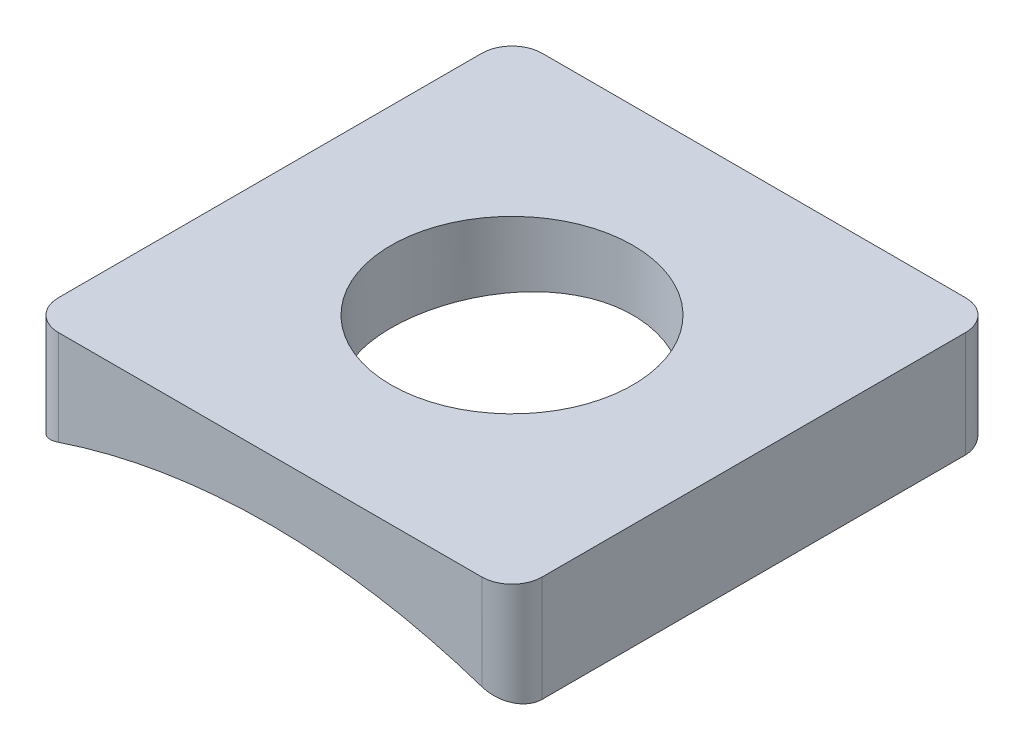
from build123d import *
from build123d.topology import SkipClean

# Parameters (mm, degrees)
DODANIE_WYCI_GNI_CIE1_DEPTH = 8
SZKIC2_R                    = 2
WYTNIJ_WYCI_GNI_CIE1_DEPTH  = 8
ZAOKR_GLENIE1_R             = 0.5


with BuildPart() as part:
    # Szkic1 → Dodanie-wyciągnięcie1 (new body)
    with BuildSketch(Plane.XY):
        with BuildLine():
            Line((0, 0.876524617), (0, -0.123475383))
            ThreePointArc((0, -0.123475383), (2.035134096, -0.3133769), (4, -0.876524617))
            Line((4, -0.876524617), (4, 0.876524617))
            Line((4, 0.876524617), (0, 0.876524617))
        make_face()
        with BuildLine():
            ThreePointArc((-4, -0.876524617), (-2.035134096, -0.3133769), (0, -0.123475383))
            Line((0, -0.123475383), (0, 0.876524617))
            Line((0, 0.876524617), (-4, 0.876524617))
            Line((-4, 0.876524617), (-4, -0.876524617))
        make_face()
    extrude(amount=DODANIE_WYCI_GNI_CIE1_DEPTH)

    # Szkic2 → Wytnij-wyciągnięcie1 (cut)
    with SkipClean():  # the faces are left unmerged after this step: merging them gives an invalid solid
        with BuildSketch(Plane(origin=(0, 0.876524617, 0), x_dir=(1, 0, 0), z_dir=(0, 1, 0))):
            with Locations(Location((0, -4, 0), (0, 0, 270))):
                Circle(SZKIC2_R)
        extrude(amount=-WYTNIJ_WYCI_GNI_CIE1_DEPTH, mode=Mode.SUBTRACT)

    # Zaokrąglenie1
    zaokr_glenie1_edges = [part.edges().sort_by_distance(p)[0] for p in [
        (4, 0, 8),
        (-4, 0, 8),
        (-4, 0, 0),
        (4, 0, 0),
    ]]
    fillet(zaokr_glenie1_edges, radius=ZAOKR_GLENIE1_R)


solid = part.part
